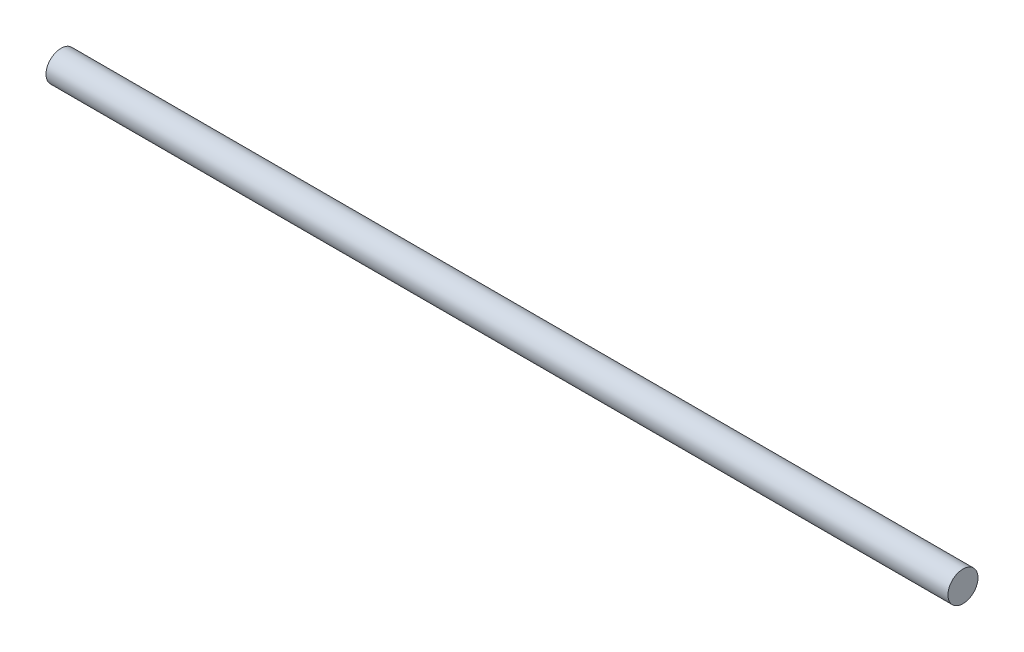
from build123d import *

# Parameters (mm, degrees)
SKETCH_1_W          = 100
SKETCH_1_H          = 2
SKETCH1_R           = 2
BOSS_EXTRUDE1_DEPTH = 20


with BuildPart() as part:
    # 草图1 → 旋转1 (revolve)
    with BuildSketch(Plane.XY, mode=Mode.PRIVATE) as revolve_1_sk:
        with Locations((0, 1)):
            Rectangle(SKETCH_1_W, SKETCH_1_H)
    revolve(revolve_1_sk.sketch.rotate(Axis((-50, 0, 0), (1, 0, 0)), 90), axis=Axis((-50, 0, 0), (1, 0, 0)))

    # Sketch1 → Boss-Extrude1 (add)
    with BuildSketch(Plane(origin=(50, 0, 0), x_dir=(0, 0, -1), z_dir=(1, 0, 0))):
        with Locations(Location((0, 0, 0), (0, 0, 180))):
            Circle(SKETCH1_R)
    extrude(amount=BOSS_EXTRUDE1_DEPTH)


solid = part.part
